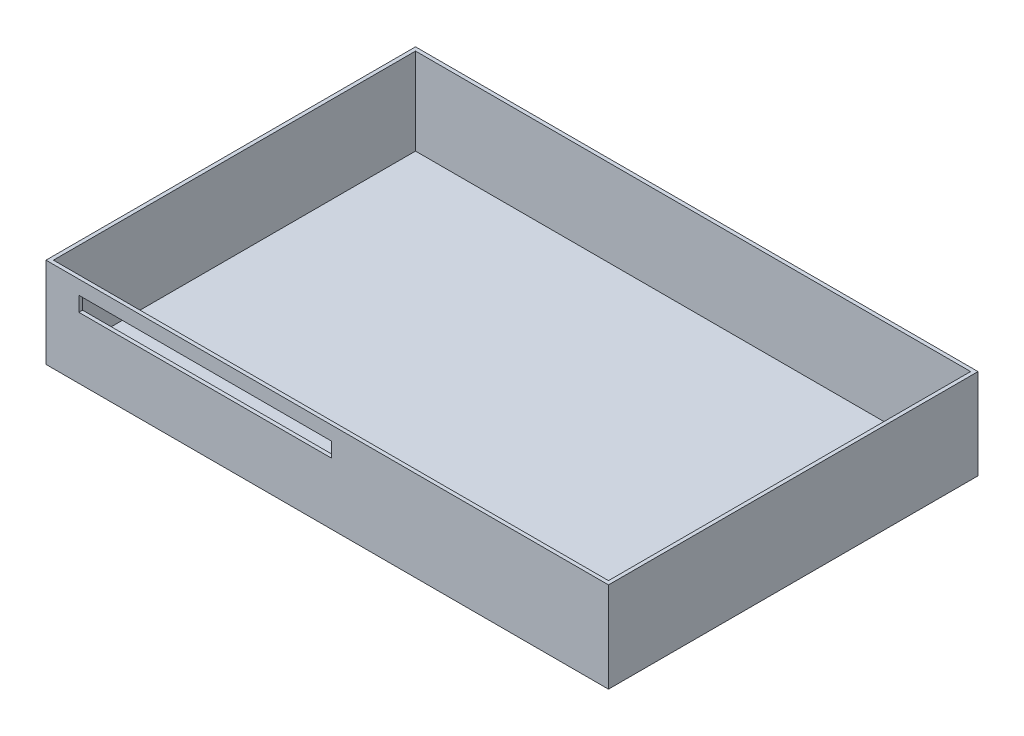
from build123d import *

# Parameters (mm, degrees)
SKETCH1_W           = 1370
SKETCH1_H           = 900
BOSS_EXTRUDE1_DEPTH = 220
SHELL1_T            = -9
CUT_EXTRUDE1_REACH  = 1655.874
SKETCH3_W           = 615
SKETCH3_H           = 36


with BuildPart() as part:
    # Sketch1 → Boss-Extrude1 (new body)
    with BuildSketch(Plane(origin=(0, 0, 0), x_dir=(1, 0, 0), z_dir=(0, 1, 0))):
        with Locations((685, 450)):
            Rectangle(SKETCH1_W, SKETCH1_H)
    extrude(amount=BOSS_EXTRUDE1_DEPTH)

    # Shell1
    shell1_openings = [part.faces().sort_by_distance(p)[0] for p in [
        (685, 220, -450),
    ]]
    offset(amount=SHELL1_T, openings=shell1_openings, kind=Kind.INTERSECTION)

    # Sketch3 → Cut-Extrude1 (cut, up to next)
    with BuildSketch(Plane.XY, mode=Mode.PRIVATE) as cut_extrude1_sk1:
        with Locations((387.5, 168)):
            Rectangle(SKETCH3_W, SKETCH3_H)
    cut_extrude1_tool1 = extrude(cut_extrude1_sk1.sketch, amount=-CUT_EXTRUDE1_REACH, mode=Mode.PRIVATE) & part.part
    add(cut_extrude1_tool1.solids().sort_by_distance((387.5, 168, 0))[0], mode=Mode.SUBTRACT)


solid = part.part
